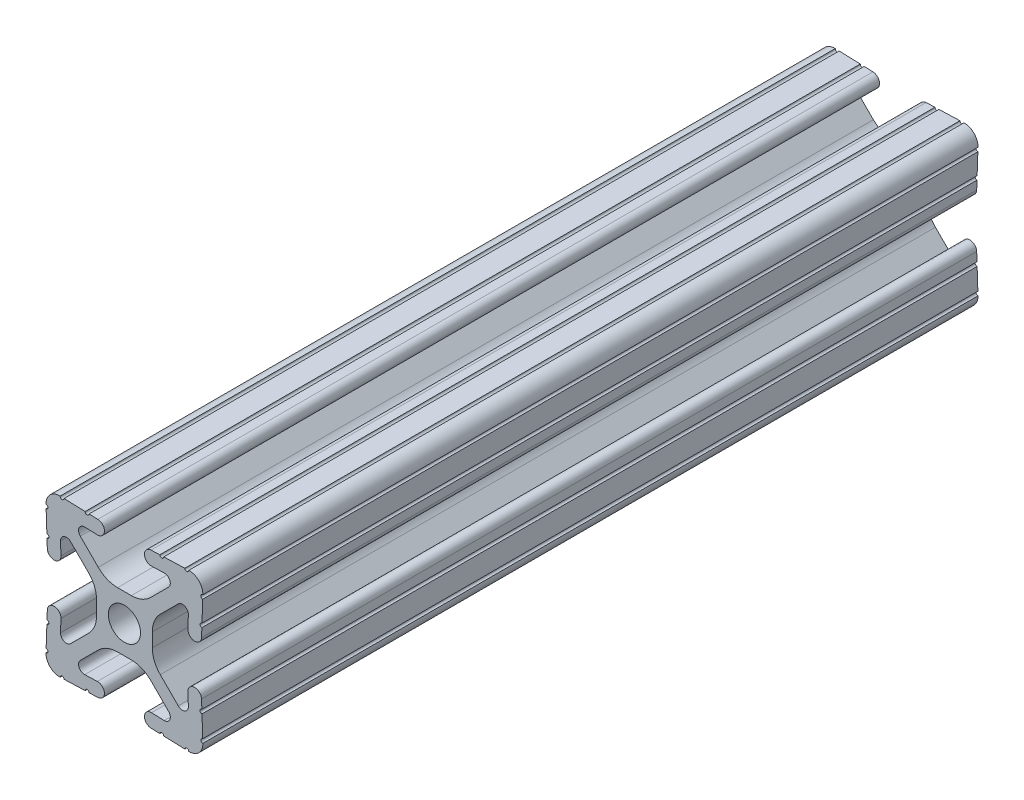
from build123d import *

# Parameters (mm, degrees)
SKETCH3_R      = 2.6035
EXTRUDE1_DEPTH = 62.749999976


with BuildPart() as part:
    # Sketch3 → Extrude1 (new, symmetric)
    with BuildSketch(Plane.XY):
        with BuildLine():
            Line((-1.115277175, 4.5085), (1.115277175, 4.5085))
            ThreePointArc((1.115277175, 4.5085), (2.806584872, 4.844922018), (4.240406305, 5.80297087))
            Line((4.240406305, 5.80297087), (7.148423664, 8.710988229))
            ThreePointArc((7.148423664, 8.710988229), (7.349906316, 9.772227925), (6.436353897, 10.348636575))
            Line((6.436353897, 10.348636575), (4.381960454, 10.276895575))
            ThreePointArc((4.381960454, 10.276895575), (3.239173075, 11.342562046), (4.304839546, 12.485349424))
            Line((4.304839546, 12.485349424), (5.728246175, 12.535055879))
            ThreePointArc((5.728246175, 12.535055879), (6.054756855, 12.230579745), (6.35923299, 12.557090424))
            Line((6.35923299, 12.557090424), (9.782092278, 12.676619304))
            ThreePointArc((9.782092278, 12.676619304), (10.108602958, 12.37214317), (10.413079092, 12.69865385))
            ThreePointArc((10.413079092, 12.69865385), (12.052764565, 12.052764565), (12.69865385, 10.413079092))
            ThreePointArc((12.69865385, 10.413079092), (12.37214317, 10.108602958), (12.676619304, 9.782092278))
            Line((12.676619304, 9.782092278), (12.557090424, 6.35923299))
            ThreePointArc((12.557090424, 6.35923299), (12.230579745, 6.054756855), (12.535055879, 5.728246175))
            Line((12.535055879, 5.728246175), (12.485349424, 4.304839546))
            ThreePointArc((12.485349424, 4.304839546), (11.342562046, 3.239173075), (10.276895575, 4.381960454))
            Line((10.276895575, 4.381960454), (10.348636575, 6.436353897))
            ThreePointArc((10.348636575, 6.436353897), (9.772227925, 7.349906316), (8.710988229, 7.148423664))
            Line((8.710988229, 7.148423664), (5.80297087, 4.240406305))
            ThreePointArc((5.80297087, 4.240406305), (4.844922018, 2.806584872), (4.5085, 1.115277175))
            Line((4.5085, 1.115277175), (4.5085, -1.115277175))
            ThreePointArc((4.5085, -1.115277175), (4.844922018, -2.806584872), (5.80297087, -4.240406305))
            Line((5.80297087, -4.240406305), (8.710988229, -7.148423664))
            ThreePointArc((8.710988229, -7.148423664), (9.772227925, -7.349906316), (10.348636575, -6.436353897))
            Line((10.348636575, -6.436353897), (10.276895575, -4.381960454))
            ThreePointArc((10.276895575, -4.381960454), (11.342562046, -3.239173075), (12.485349424, -4.304839546))
            Line((12.485349424, -4.304839546), (12.535055879, -5.728246175))
            ThreePointArc((12.535055879, -5.728246175), (12.230579745, -6.054756855), (12.557090424, -6.35923299))
            Line((12.557090424, -6.35923299), (12.676619304, -9.782092278))
            ThreePointArc((12.676619304, -9.782092278), (12.37214317, -10.108602958), (12.69865385, -10.413079092))
            ThreePointArc((12.69865385, -10.413079092), (12.052764565, -12.052764565), (10.413079092, -12.69865385))
            ThreePointArc((10.413079092, -12.69865385), (10.108602958, -12.37214317), (9.782092278, -12.676619304))
            Line((9.782092278, -12.676619304), (6.35923299, -12.557090424))
            ThreePointArc((6.35923299, -12.557090424), (6.054756855, -12.230579745), (5.728246175, -12.535055879))
            Line((5.728246175, -12.535055879), (4.304839546, -12.485349424))
            ThreePointArc((4.304839546, -12.485349424), (3.239173075, -11.342562046), (4.381960454, -10.276895575))
            Line((4.381960454, -10.276895575), (6.436353897, -10.348636575))
            ThreePointArc((6.436353897, -10.348636575), (7.349906316, -9.772227925), (7.148423664, -8.710988229))
            Line((7.148423664, -8.710988229), (4.240406305, -5.80297087))
            ThreePointArc((4.240406305, -5.80297087), (2.806584872, -4.844922018), (1.115277175, -4.5085))
            Line((1.115277175, -4.5085), (-1.115277175, -4.5085))
            ThreePointArc((-1.115277175, -4.5085), (-2.806584872, -4.844922018), (-4.240406305, -5.80297087))
            Line((-4.240406305, -5.80297087), (-7.148423664, -8.710988229))
            ThreePointArc((-7.148423664, -8.710988229), (-7.349906316, -9.772227925), (-6.436353897, -10.348636575))
            Line((-6.436353897, -10.348636575), (-4.381960454, -10.276895575))
            ThreePointArc((-4.381960454, -10.276895575), (-3.239173075, -11.342562046), (-4.304839546, -12.485349424))
            Line((-4.304839546, -12.485349424), (-5.728246175, -12.535055879))
            ThreePointArc((-5.728246175, -12.535055879), (-6.054756855, -12.230579745), (-6.35923299, -12.557090424))
            Line((-6.35923299, -12.557090424), (-9.782092278, -12.676619304))
            ThreePointArc((-9.782092278, -12.676619304), (-10.108602958, -12.37214317), (-10.413079092, -12.69865385))
            ThreePointArc((-10.413079092, -12.69865385), (-12.052764565, -12.052764565), (-12.69865385, -10.413079092))
            ThreePointArc((-12.69865385, -10.413079092), (-12.37214317, -10.108602958), (-12.676619304, -9.782092278))
            Line((-12.676619304, -9.782092278), (-12.557090424, -6.35923299))
            ThreePointArc((-12.557090424, -6.35923299), (-12.230579745, -6.054756855), (-12.535055879, -5.728246175))
            Line((-12.535055879, -5.728246175), (-12.485349424, -4.304839546))
            ThreePointArc((-12.485349424, -4.304839546), (-11.342562046, -3.239173075), (-10.276895575, -4.381960454))
            Line((-10.276895575, -4.381960454), (-10.348636575, -6.436353897))
            ThreePointArc((-10.348636575, -6.436353897), (-9.772227925, -7.349906316), (-8.710988229, -7.148423664))
            Line((-8.710988229, -7.148423664), (-5.80297087, -4.240406305))
            ThreePointArc((-5.80297087, -4.240406305), (-4.844922018, -2.806584872), (-4.5085, -1.115277175))
            Line((-4.5085, -1.115277175), (-4.5085, 1.115277175))
            ThreePointArc((-4.5085, 1.115277175), (-4.844922018, 2.806584872), (-5.80297087, 4.240406305))
            Line((-5.80297087, 4.240406305), (-8.710988229, 7.148423664))
            ThreePointArc((-8.710988229, 7.148423664), (-9.772227925, 7.349906316), (-10.348636575, 6.436353897))
            Line((-10.348636575, 6.436353897), (-10.276895575, 4.381960454))
            ThreePointArc((-10.276895575, 4.381960454), (-11.342562046, 3.239173075), (-12.485349424, 4.304839546))
            Line((-12.485349424, 4.304839546), (-12.535055879, 5.728246175))
            ThreePointArc((-12.535055879, 5.728246175), (-12.230579745, 6.054756855), (-12.557090424, 6.35923299))
            Line((-12.557090424, 6.35923299), (-12.676619304, 9.782092278))
            ThreePointArc((-12.676619304, 9.782092278), (-12.37214317, 10.108602958), (-12.69865385, 10.413079092))
            ThreePointArc((-12.69865385, 10.413079092), (-12.052764565, 12.052764565), (-10.413079092, 12.69865385))
            ThreePointArc((-10.413079092, 12.69865385), (-10.108602958, 12.37214317), (-9.782092278, 12.676619304))
            Line((-9.782092278, 12.676619304), (-6.35923299, 12.557090424))
            ThreePointArc((-6.35923299, 12.557090424), (-6.054756855, 12.230579745), (-5.728246175, 12.535055879))
            Line((-5.728246175, 12.535055879), (-4.304839546, 12.485349424))
            ThreePointArc((-4.304839546, 12.485349424), (-3.239173075, 11.342562046), (-4.381960454, 10.276895575))
            Line((-4.381960454, 10.276895575), (-6.436353897, 10.348636575))
            ThreePointArc((-6.436353897, 10.348636575), (-7.349906316, 9.772227925), (-7.148423664, 8.710988229))
            Line((-7.148423664, 8.710988229), (-4.240406305, 5.80297087))
            ThreePointArc((-4.240406305, 5.80297087), (-2.806584872, 4.844922018), (-1.115277175, 4.5085))
        make_face()
        Circle(SKETCH3_R, mode=Mode.SUBTRACT)
    extrude(amount=EXTRUDE1_DEPTH, both=True)


solid = part.part
